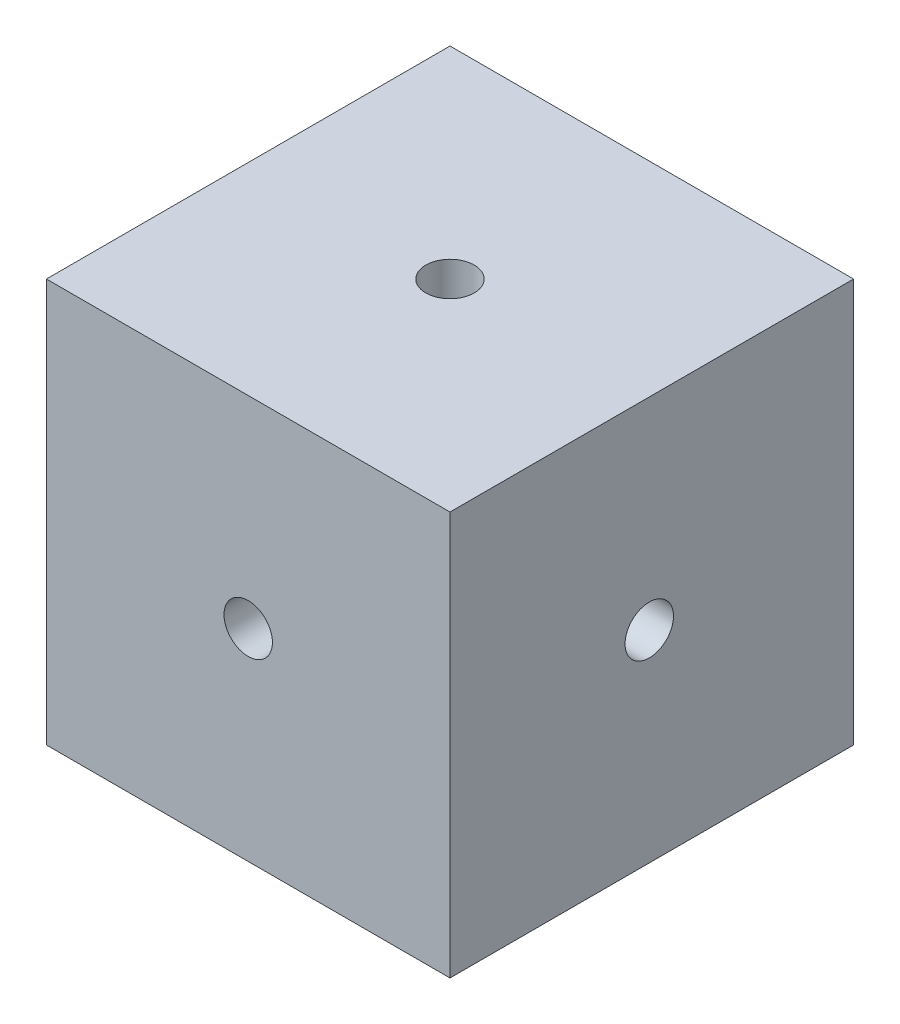
from build123d import *

# Parameters (mm, degrees)
SKETCH1_W           = 25
SKETCH1_H           = 25
BOSS_EXTRUDE3_DEPTH = 25
SKETCH3_R           = 1.5
CUT_EXTRUDE1_DEPTH  = 7
SKETCH4_R           = 1.5
CUT_EXTRUDE2_DEPTH  = 7
SKETCH5_R           = 1.5
CUT_EXTRUDE3_DEPTH  = 7
CUT_EXTRUDE4_START  = -7
SKETCH6_R           = 1.5
CUT_EXTRUDE4_DEPTH  = 7
SKETCH7_R           = 1.5
CUT_EXTRUDE5_DEPTH  = 7


with BuildPart() as part:
    # Sketch1 → Boss-Extrude3 (new body)
    with BuildSketch(Plane.XY):
        Rectangle(SKETCH1_W, SKETCH1_H)
    extrude(amount=BOSS_EXTRUDE3_DEPTH)

    # Sketch3 → Cut-Extrude1 (cut)
    with BuildSketch(Plane(origin=(0, 12.5, 0), x_dir=(1, 0, 0), z_dir=(0, 1, 0))):
        with Locations(Location((0, -12.5, 0), (0, 0, 270))):
            Circle(SKETCH3_R)
    extrude(amount=-CUT_EXTRUDE1_DEPTH, mode=Mode.SUBTRACT)

    # Sketch4 → Cut-Extrude2 (cut)
    with BuildSketch(Plane.XY.offset(25)):
        Circle(SKETCH4_R)
    extrude(amount=-CUT_EXTRUDE2_DEPTH, mode=Mode.SUBTRACT)

    # Sketch5 → Cut-Extrude3 (cut)
    with BuildSketch(Plane(origin=(12.5, 0, 0), x_dir=(0, 0, -1), z_dir=(1, 0, 0))):
        with Locations((-12.656245037, 0)):
            Circle(SKETCH5_R)
    extrude(amount=-CUT_EXTRUDE3_DEPTH, mode=Mode.SUBTRACT)

    # Sketch6 → Cut-Extrude4 (cut)
    with BuildSketch(Plane(origin=(0, 0, 0), x_dir=(-1, 0, 0), z_dir=(0, 0, -1)).offset(CUT_EXTRUDE4_START)):
        with Locations(Location((0, 0, 0), (0, 0, 180))):
            Circle(SKETCH6_R)
    extrude(amount=CUT_EXTRUDE4_DEPTH, mode=Mode.SUBTRACT)

    # Sketch7 → Cut-Extrude5 (cut)
    with BuildSketch(Plane.ZY.offset(12.5)):
        with Locations((12.5, 0)):
            Circle(SKETCH7_R)
    extrude(amount=-CUT_EXTRUDE5_DEPTH, mode=Mode.SUBTRACT)


solid = part.part
